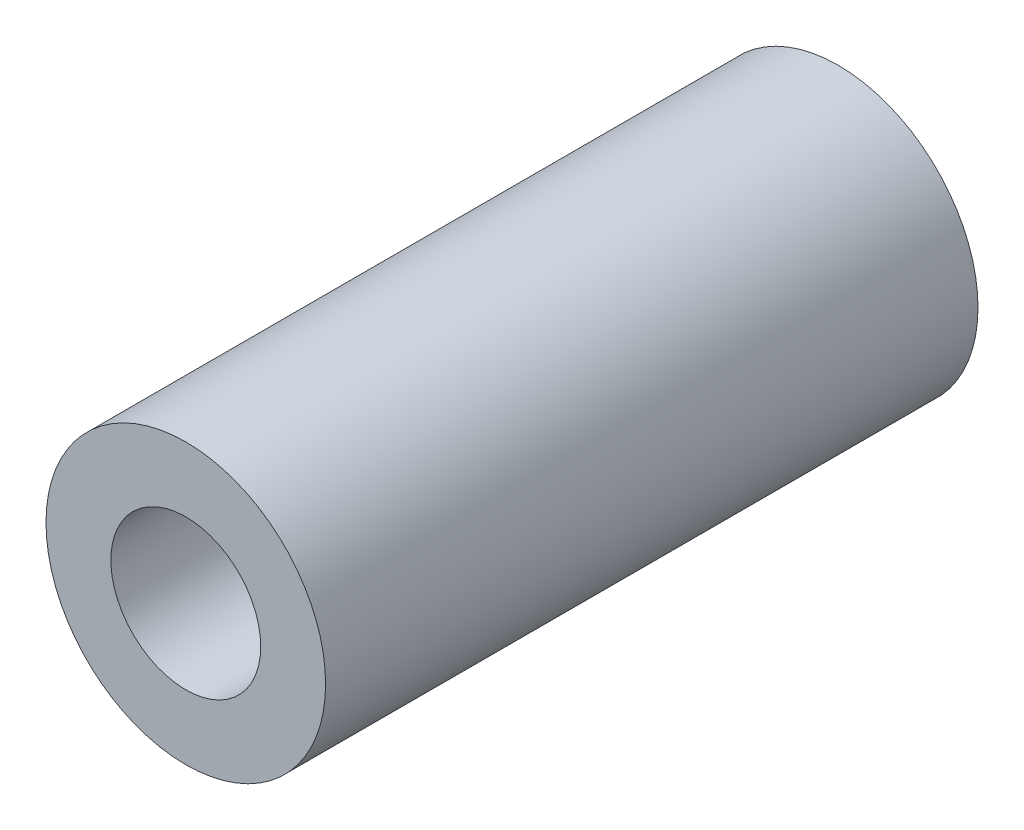
from build123d import *

# Parameters (mm, degrees)
SKETCH1_R              = 4.7625
BOSS_EXTRUDE1_DEPTH    = 22.225
F_10_CLEARANCE_HOLE1_D = 5.1054


with BuildPart() as part:
    # Sketch1 → Boss-Extrude1 (new body)
    with BuildSketch(Plane.XY):
        Circle(SKETCH1_R)
    extrude(amount=BOSS_EXTRUDE1_DEPTH)

    # #10 Clearance Hole1 (through all)
    with Locations(Plane.XY.offset(22.225)):
        with Locations((0, 0)):
            Hole(F_10_CLEARANCE_HOLE1_D / 2)


solid = part.part
